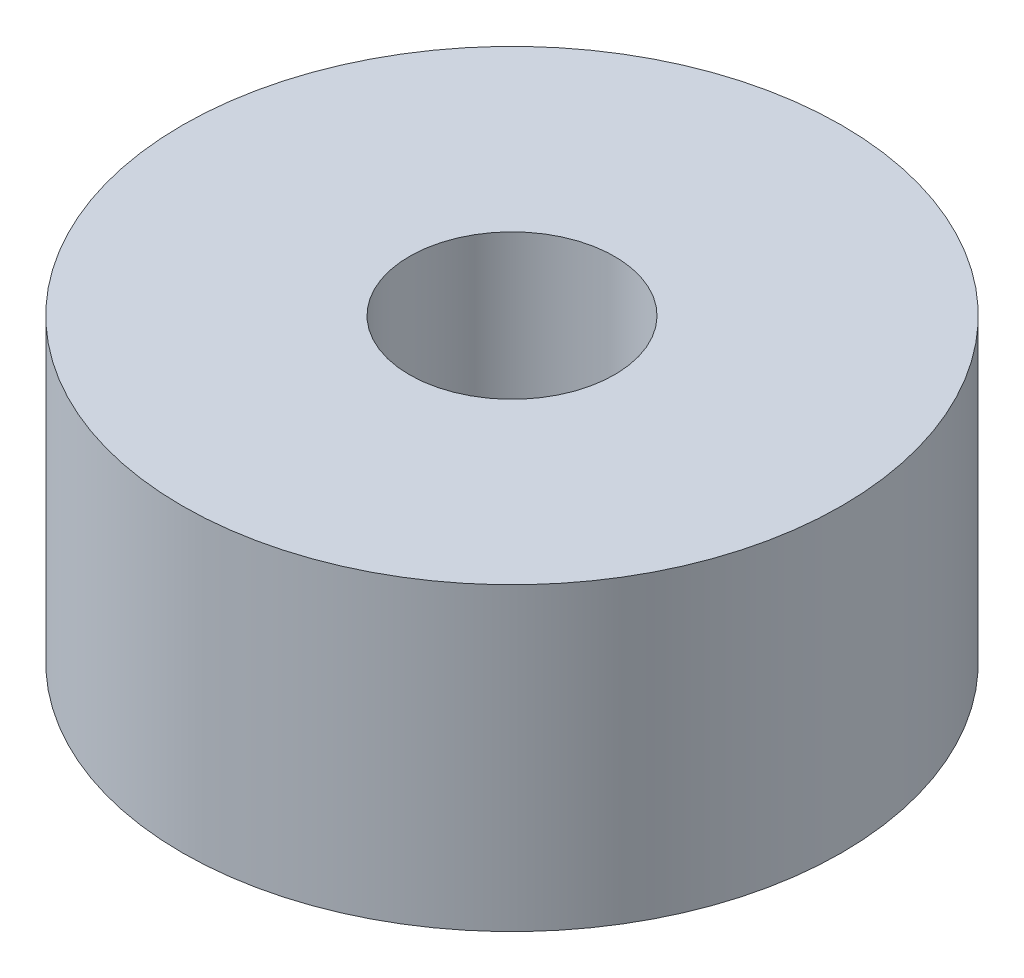
from build123d import *

# Parameters (mm, degrees)
SKETCH_1_R      = 9
SKETCH_1_R_2    = 2.8
EXTRUDE_1_DEPTH = 4.1


with BuildPart() as part:
    # 草圖1 → 填料-伸長1 (new, symmetric)
    with BuildSketch(Plane(origin=(0, 0, 0), x_dir=(1, 0, 0), z_dir=(0, 1, 0))):
        with Locations(Location((0, 0, 0), (0, 0, 270))):
            Circle(SKETCH_1_R)
        with Locations(Location((0, 0, 0), (0, 0, 270))):
            Circle(SKETCH_1_R_2, mode=Mode.SUBTRACT)
    extrude(amount=EXTRUDE_1_DEPTH, both=True)


solid = part.part
